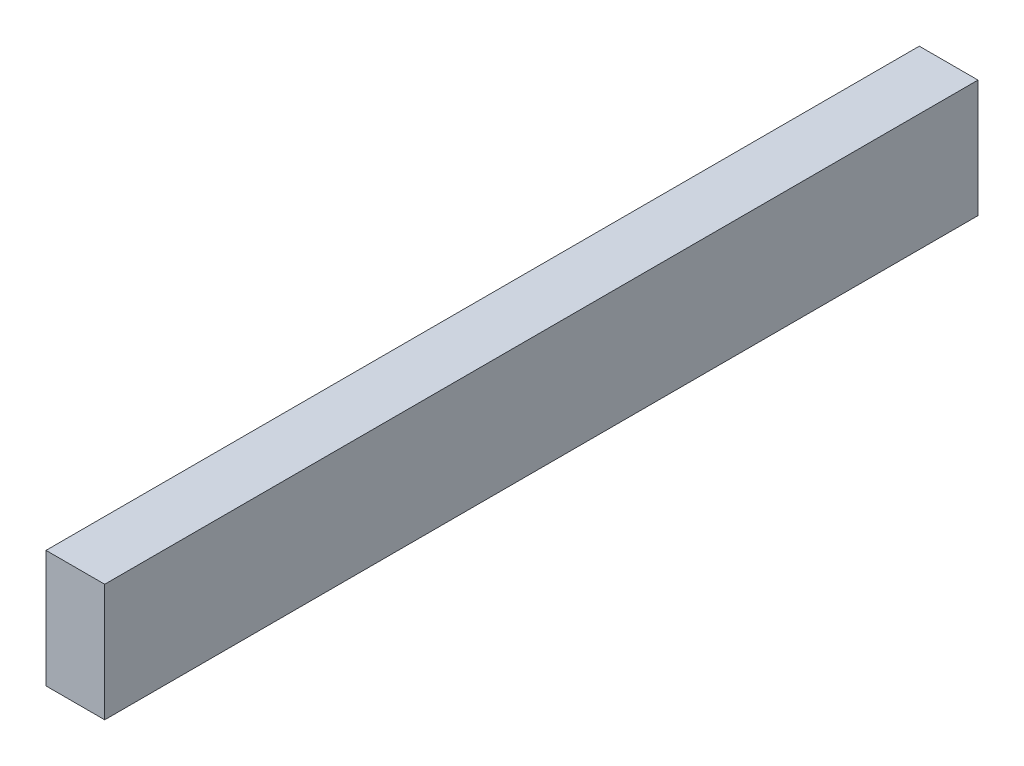
from build123d import *

# Parameters (mm, degrees)
SKETCH1_W           = 50.8
SKETCH1_H           = 755.65
BOSS_EXTRUDE1_DEPTH = 101.6


with BuildPart() as part:
    # Sketch1 → Boss-Extrude1 (new body)
    with BuildSketch(Plane(origin=(0, 0, 0), x_dir=(1, 0, 0), z_dir=(0, 1, 0))):
        with Locations((0.042044922, 366.578734684)):
            Rectangle(SKETCH1_W, SKETCH1_H)
    extrude(amount=-BOSS_EXTRUDE1_DEPTH)


solid = part.part
